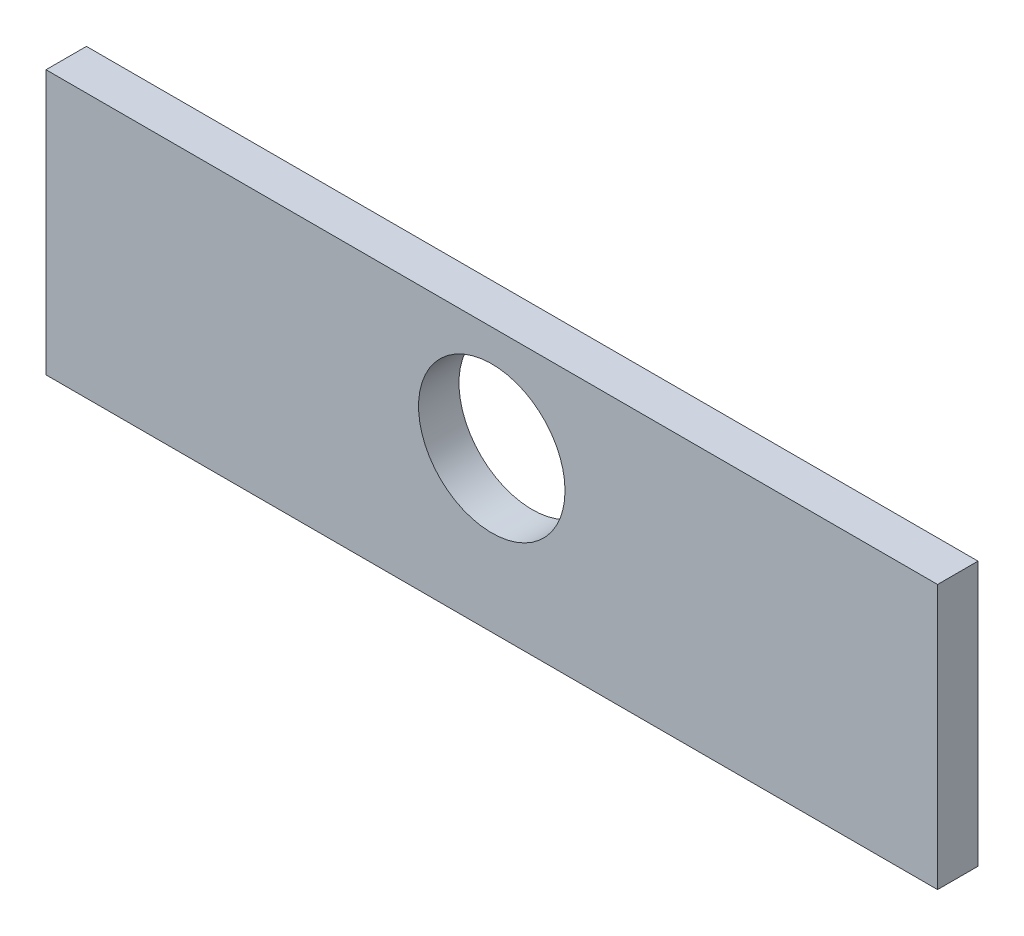
from build123d import *

# Parameters (mm, degrees)
SKETCH1_W           = 140
SKETCH1_H           = 41.5
BOSS_EXTRUDE1_DEPTH = 6.35
SKETCH2_R           = 11.5
CUT_EXTRUDE1_DEPTH  = 74.286322053


with BuildPart() as part:
    # Sketch1 → Boss-Extrude1 (new body)
    with BuildSketch(Plane.XY):
        Rectangle(SKETCH1_W, SKETCH1_H)
    extrude(amount=BOSS_EXTRUDE1_DEPTH)

    # Sketch2 → Cut-Extrude1 (cut, through all)
    with BuildSketch(Plane.XY.offset(6.35)):
        with Locations((0, 4.25)):
            Circle(SKETCH2_R)
    extrude(amount=-CUT_EXTRUDE1_DEPTH, mode=Mode.SUBTRACT)


solid = part.part
